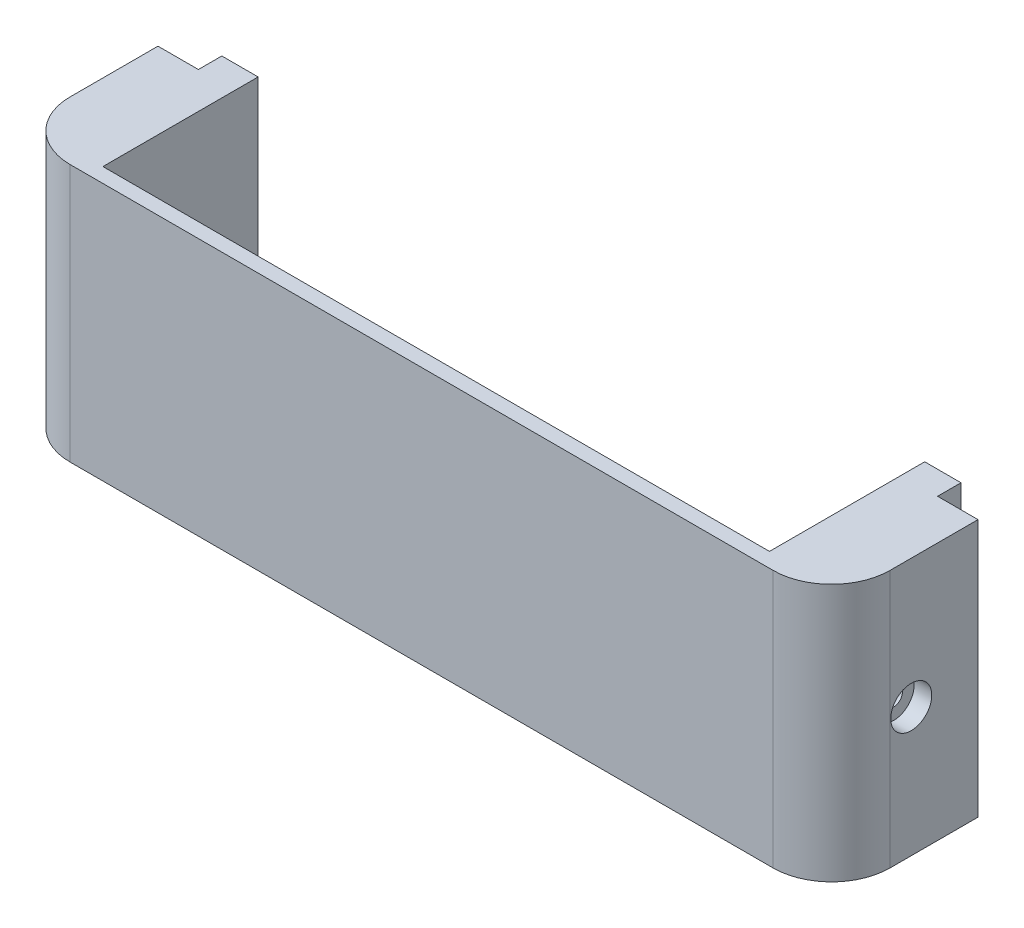
from build123d import *

# Parameters (mm, degrees)
EXTRUDE_1_DEPTH      = 14
CUT_EXTRUDE_1_DEPTH  = 44
SKETCH_3_W           = 6.2
SKETCH_3_H           = 6.2
CUT_EXTRUDE_2_DEPTH  = 4
SKETCH_4_R           = 4
CUT_EXTRUDE_3_DEPTH  = 5
SKETCH_5_R           = 2.6
CUT_EXTRUDE_4_DEPTH  = 5
SKETCH_6_R           = 4
EXTRUDE_2_DEPTH      = 10
SKETCH_7_W           = 6.2
SKETCH_7_H           = 4
EXTRUDE_3_DEPTH      = 40
CUT_EXTRUDE_5_DEPTH  = 50
SKETCH_9_W           = 20
SKETCH_9_H           = 25
EXTRUDE_4_DEPTH      = 44
CUT_EXTRUDE_6_DEPTH  = 44
EXTRUDE_5_DEPTH      = 44
SKETCH_12_W          = 6.9
SKETCH_12_H          = 22.5
CUT_EXTRUDE_7_DEPTH  = 50
SKETCH_13_R          = 3.5
CUT_EXTRUDE_9_DEPTH  = 3
CUT_EXTRUDE_START    = -3
SKETCH_14_R          = 3.5
CUT_EXTRUDE_10_DEPTH = 3
SKETCH_15_R          = 1.51
CUT_EXTRUDE_11_DEPTH = 200


with BuildPart() as part:
    # 草图1 → 凸台-拉伸1 (new body)
    with BuildSketch(Plane.XY):
        Polygon((-15, 22), (-15, -22), (15, -22), (15, 22), (0, 22), align=None)
    extrude(amount=EXTRUDE_1_DEPTH)

    # 草图2 → 切除-拉伸1 (cut)
    with BuildSketch(Plane(origin=(0, 22, 0), x_dir=(1, 0, 0), z_dir=(0, 1, 0))):
        Polygon((-15, 0), (-15, -14), (-10, -4), (-3.1, -4), (-3.1, 0), align=None)
        Polygon((3.1, -4), (10, -4), (15, -14), (15, 0), (3.1, 0), align=None)
    extrude(amount=-CUT_EXTRUDE_1_DEPTH, mode=Mode.SUBTRACT)

    # 草图3 → 切除-拉伸2 (cut)
    with BuildSketch(Plane(origin=(0, 0, 0), x_dir=(-1, 0, 0), z_dir=(0, 0, -1))):
        Rectangle(SKETCH_3_W, SKETCH_3_H)
    extrude(amount=-CUT_EXTRUDE_2_DEPTH, mode=Mode.SUBTRACT)

    # 草图4 → 切除-拉伸3 (cut)
    with BuildSketch(Plane.XY.offset(14)):
        Circle(SKETCH_4_R)
    extrude(amount=-CUT_EXTRUDE_3_DEPTH, mode=Mode.SUBTRACT)

    # 草图5 → 切除-拉伸4 (cut)
    with BuildSketch(Plane.XY.offset(9)):
        Circle(SKETCH_5_R)
    extrude(amount=-CUT_EXTRUDE_4_DEPTH, mode=Mode.SUBTRACT)

    # 草图6 → 凸台-拉伸2 (add)
    with BuildSketch(Plane.XY.offset(14)):
        Circle(SKETCH_6_R)
    extrude(amount=-EXTRUDE_2_DEPTH)

    # 草图7 → 凸台-拉伸3 (add)
    with BuildSketch(Plane(origin=(0, -22, 0), x_dir=(-1, 0, 0), z_dir=(0, -1, 0))):
        with Locations((0, -2)):
            Rectangle(SKETCH_7_W, SKETCH_7_H)
    extrude(amount=-EXTRUDE_3_DEPTH)

    # 草图8 → 切除-拉伸5 (cut)
    with BuildSketch(Plane.XZ.offset(22)):
        Polygon((-15, 14), (-10, 4), (-10, 14), align=None)
        Polygon((15, 14), (10, 14), (10, 4), align=None)
    extrude(amount=-CUT_EXTRUDE_5_DEPTH, mode=Mode.SUBTRACT)

    # 草图9 → 凸台-拉伸4 (add)
    with BuildSketch(Plane.XZ.offset(22)):
        with Locations((0, 16.5)):
            Rectangle(SKETCH_9_W, SKETCH_9_H)
    extrude(amount=-EXTRUDE_4_DEPTH)

    # 草图10 → 切除-拉伸6 (cut)
    with BuildSketch(Plane.XZ.offset(22)):
        with BuildLine():
            Line((-10, 29), (-10, 19))
            ThreePointArc((-10, 19), (-7.071067812, 26.071067812), (0, 29))
            Line((0, 29), (-10, 29))
        make_face()
    extrude(amount=-CUT_EXTRUDE_6_DEPTH, mode=Mode.SUBTRACT)

    # 草图11 → 凸台-拉伸5 (add)
    with BuildSketch(Plane.XZ.offset(22)):
        with BuildLine():
            Line((120, 0), (123.1, 0))
            Line((123.1, 0), (123.1, 4))
            Line((123.1, 4), (130, 4))
            Line((130, 4), (130, 19))
            ThreePointArc((130, 19), (127.071067812, 26.071067812), (120, 29))
            Line((120, 29), (110, 29))
            Line((110, 29), (10, 29))
            Line((10, 29), (10, 26.5))
            Line((10, 26.5), (110, 26.5))
            Line((110, 26.5), (110, 4))
            Line((110, 4), (116.9, 4))
            Line((116.9, 4), (116.9, 0))
            Line((116.9, 0), (120, 0))
        make_face()
    extrude(amount=-EXTRUDE_5_DEPTH)

    # 草图12 → 切除-拉伸7 (cut)
    with BuildSketch(Plane(origin=(0, 22, 0), x_dir=(1, 0, 0), z_dir=(0, 1, 0))):
        with Locations((6.55, -15.25)):
            Rectangle(SKETCH_12_W, SKETCH_12_H)
        with Locations((113.45, -15.25)):
            Rectangle(SKETCH_12_W, SKETCH_12_H)
    extrude(amount=-CUT_EXTRUDE_7_DEPTH, mode=Mode.SUBTRACT)

    # 草图13 → 切除-拉伸9 (cut)
    with BuildSketch(Plane(origin=(130, 0, 0), x_dir=(0, 0, -1), z_dir=(1, 0, 0))):
        with Locations((-15.4, 0)):
            Circle(SKETCH_13_R)
    extrude(amount=-CUT_EXTRUDE_9_DEPTH, mode=Mode.SUBTRACT)

    # 草图14 → 切除-拉伸10 (cut)
    with BuildSketch(Plane.ZY.offset(10).offset(CUT_EXTRUDE_START)):
        with Locations(Location((15.4, 0, 0), (0, 0, 180))):
            Circle(SKETCH_14_R)
    extrude(amount=CUT_EXTRUDE_10_DEPTH, mode=Mode.SUBTRACT)

    # 草图15 → 切除-拉伸11 (cut)
    with BuildSketch(Plane.ZY.offset(7)):
        with Locations(Location((15.4, 0, 0), (0, 0, 270))):
            Circle(SKETCH_15_R)
    extrude(amount=-CUT_EXTRUDE_11_DEPTH, mode=Mode.SUBTRACT)


solid = part.part
